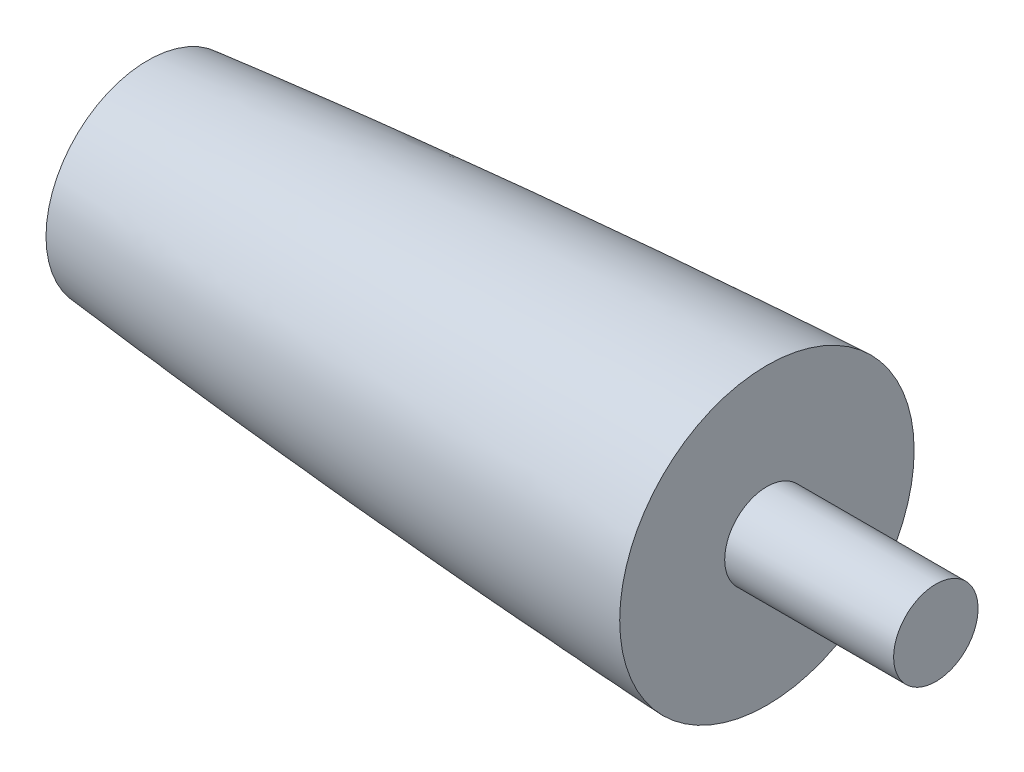
from build123d import *

# Parameters (mm, degrees)
SKETCH2_R          = 12.7
CUT_EXTRUDE1_DEPTH = 50.8


with BuildPart() as part:
    # Sketch1 → Revolve1 (revolve)
    with BuildSketch(Plane(origin=(0, 0, 0), x_dir=(1, 0, 0), z_dir=(0, 1, 0)), mode=Mode.PRIVATE) as revolve1_sk:
        with BuildLine():
            Line((186.200000001, 30.594170705), (186.200000001, 0))
            Line((186.200000001, 0), (423.200000001, 0))
            Line((423.200000001, 0), (423.200000001, 12.700000001))
            Line((423.200000001, 12.700000001), (372.4, 12.700000001))
            Line((372.4, 12.700000001), (372.4, 44.273309897))
            add(Edge.make_bspline(
                [(186.200000001, 30.594170705), (186.84766521, 30.659423119), (188.168076883, 30.791890482), (191.918845769, 31.166408582), (196.124455044, 31.578414536), (201.840886625, 32.131151998), (207.893685758, 32.701682781), (214.205422429, 33.28578459), (220.368431816, 33.842643509), (226.62220802, 34.3966159), (232.82278134, 34.933435215), (239.057201083, 35.462055862), (245.27268644, 35.977399589), (251.501020324, 36.482788699), (259.127242372, 37.088012955), (268.317687959, 37.796565894), (279.05899058, 38.594819148), (289.813469819, 39.358798501), (299.150136566, 39.99708407), (306.950409458, 40.51351894), (313.159719824, 40.915327722), (319.432376423, 41.310624435), (325.595023531, 41.690859903), (331.944868665, 42.070929833), (337.985390815, 42.426210406), (344.538046525, 42.797662782), (350.247968857, 43.117953172), (357.349407841, 43.498323428), (362.148157595, 43.755040764), (368.611069259, 44.083306474), (371.099720463, 44.208615145), (372.4, 44.273309897)],
                knots=[0.082776805, 0.082776805, 0.082776805, 0.082776805, 0.082776805, 0.096721516, 0.110666227, 0.138555648, 0.166445069, 0.19433449, 0.222223911, 0.250113332, 0.278002753, 0.305892174, 0.333781595, 0.361671016, 0.389560438, 0.417449858, 0.470511269, 0.526290111, 0.582068953, 0.609958374, 0.637847796, 0.665737217, 0.693626638, 0.721516059, 0.74940548, 0.777294901, 0.805184322, 0.833073743, 0.860963164, 0.888852585, 0.916742006, 0.916742006, 0.916742006, 0.916742006, 0.916742006], degree=4))
        make_face()
    revolve(revolve1_sk.sketch.rotate(Axis((186.200000001, 0, 0), (1, 0, 0)), 180), axis=Axis((186.200000001, 0, 0), (1, 0, 0)))

    # Sketch2 → Cut-Extrude1 (cut)
    with BuildSketch(Plane.ZY.offset(-186.200000001)):
        Circle(SKETCH2_R)
    extrude(amount=-CUT_EXTRUDE1_DEPTH, mode=Mode.SUBTRACT)


solid = part.part
